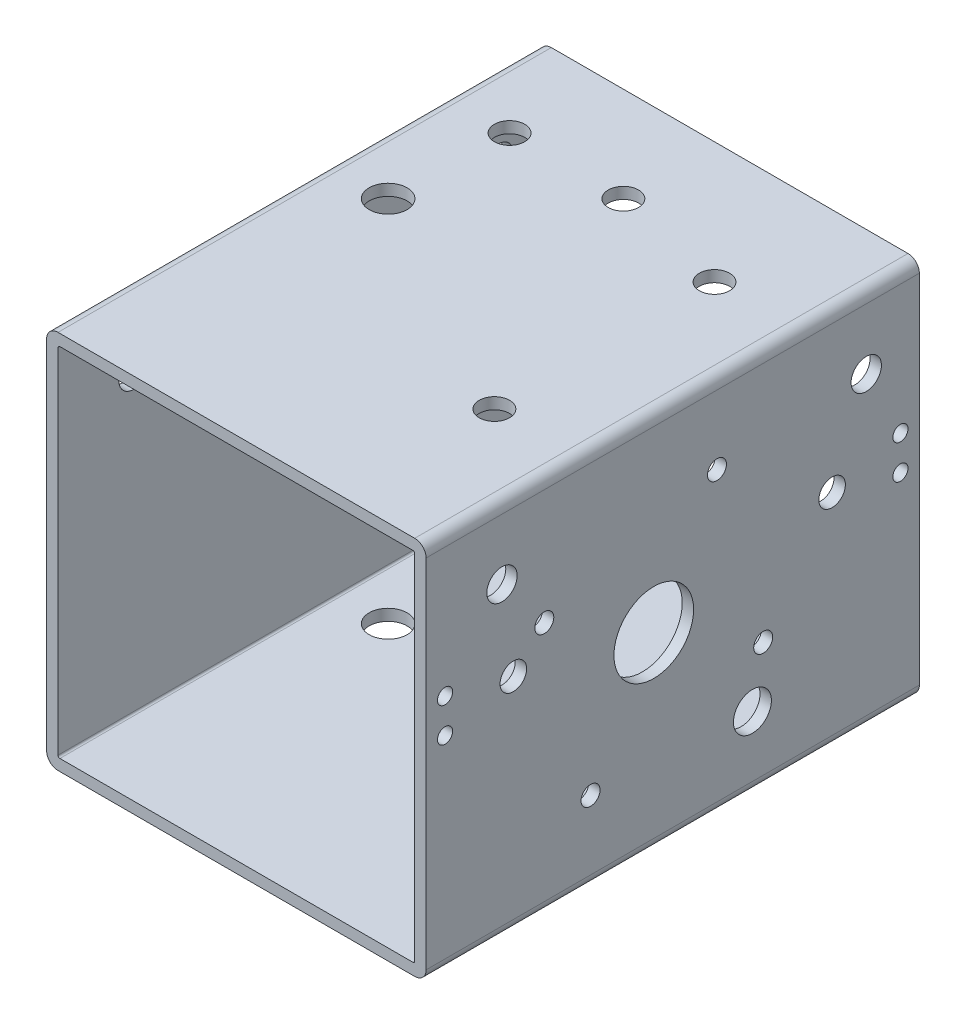
from build123d import *

# Parameters (mm, degrees)
SKETCH1_W                      = 100
SKETCH1_H                      = 100
SKETCH1_W_2                    = 94
SKETCH1_H_2                    = 94
EXTRUDE_THIN1_DEPTH            = 130
FILLET1_R                      = 0.5
FILLET2_R                      = 3
F_8_0_8_DIAMETER_HOLE2_D       = 8
F_8_0_8_DIAMETER_HOLE3_D       = 8
F_10_0_10_DIAMETER_HOLE1_D     = 10
F_10_0_10_DIAMETER_HOLE2_D     = 10
M8X1_25_TAPPED_HOLE1_D         = 6.8
M8X1_25_TAPPED_HOLE1_DEPTH     = 3
M8X1_25_TAPPED_HOLE2_D         = 6.8
M8X1_25_TAPPED_HOLE2_DEPTH     = 3
F_21_0_21_DIAMETER_HOLE1_D     = 21
F_21_0_21_DIAMETER_HOLE1_DEPTH = 3
F_5_0_5_DIAMETER_HOLE1_D       = 5
F_5_0_5_DIAMETER_HOLE1_DEPTH   = 3
F_8_0_8_DIAMETER_HOLE4_D       = 8
F_8_0_8_DIAMETER_HOLE4_DEPTH   = 3
CUT_EXTRUDE1_REACH             = 173.464
SKETCH31_R                     = 2
SKETCH31_R_2                   = 3.5
F_8_0_8_DIAMETER_HOLE5_D       = 8
F_8_0_8_DIAMETER_HOLE5_DEPTH   = 3


with BuildPart() as part:
    # Sketch1 → Extrude-Thin1 (new body)
    with BuildSketch(Plane.XY):
        Rectangle(SKETCH1_W, SKETCH1_H)
        Rectangle(SKETCH1_W_2, SKETCH1_H_2, mode=Mode.SUBTRACT)
    extrude(amount=EXTRUDE_THIN1_DEPTH)

    # Fillet1
    fillet1_edges = [part.edges().sort_by_distance(p)[0] for p in [
        (47, -47, 65),
        (47, 47, 65),
        (-47, 47, 65),
        (-47, -47, 65),
    ]]
    fillet(fillet1_edges, radius=FILLET1_R)

    # Fillet2
    fillet2_edges = [part.edges().sort_by_distance(p)[0] for p in [
        (50, -50, 65),
        (-50, -50, 65),
        (-50, 50, 65),
        (50, 50, 65),
    ]]
    fillet(fillet2_edges, radius=FILLET2_R)

    # Ø8.0 (8) Diameter Hole2 (through all)
    with Locations(Plane(origin=(0, 50, 0), x_dir=(1, 0, 0), z_dir=(0, 1, 0))):
        with Locations((28, -32), (28, -90)):
            Hole(F_8_0_8_DIAMETER_HOLE2_D / 2)

    # Ø8.0 (8) Diameter Hole3 (through all)
    with Locations(Plane(origin=(50, 0, 0), x_dir=(0, 0, -1), z_dir=(1, 0, 0))):
        with Locations((-14, 31), (-110, 31)):
            Hole(F_8_0_8_DIAMETER_HOLE3_D / 2)

    # Ø10.0 (10) Diameter Hole1 (through all)
    with Locations(Plane(origin=(0, 50, 0), x_dir=(1, 0, 0), z_dir=(0, 1, 0))):
        with Locations((-34, -56)):
            Hole(F_10_0_10_DIAMETER_HOLE1_D / 2)

    # Ø10.0 (10) Diameter Hole2 (through all)
    with Locations(Plane(origin=(50, 0, 0), x_dir=(0, 0, -1), z_dir=(1, 0, 0))):
        with Locations((-44, -31)):
            Hole(F_10_0_10_DIAMETER_HOLE2_D / 2)

    # M8x1.25 Tapped Hole1
    with Locations(Plane.ZY.offset(50)):
        with Locations((56, -15), (56, 35)):
            Hole(M8X1_25_TAPPED_HOLE1_D / 2, depth=M8X1_25_TAPPED_HOLE1_DEPTH)

    # M8x1.25 Tapped Hole2
    with Locations(Plane(origin=(0, -50, 0), x_dir=(-1, 0, 0), z_dir=(0, -1, 0))):
        with Locations((20, -44), (-35, -44)):
            Hole(M8X1_25_TAPPED_HOLE2_D / 2, depth=M8X1_25_TAPPED_HOLE2_DEPTH)

    # Ø21.0 (21) Diameter Hole1
    with Locations(Plane(origin=(50, 0, 0), x_dir=(0, 0, -1), z_dir=(1, 0, 0))):
        with Locations((-70, 0)):
            Hole(F_21_0_21_DIAMETER_HOLE1_D / 2, depth=F_21_0_21_DIAMETER_HOLE1_DEPTH)

    # Ø5.0 (5) Diameter Hole1
    with Locations(Plane(origin=(50, 0, 0), x_dir=(0, 0, -1), z_dir=(1, 0, 0))):
        with Locations((-41.157258279, -16.652364697), (-53.347635303, 28.842741721), (-98.842741721, 16.652364697), (-86.652364697, -28.842741721)):
            Hole(F_5_0_5_DIAMETER_HOLE1_D / 2, depth=F_5_0_5_DIAMETER_HOLE1_DEPTH)

    # Ø8.0 (8) Diameter Hole4
    with Locations(Plane(origin=(0, 50, 0), x_dir=(1, 0, 0), z_dir=(0, 1, 0))):
        with Locations((-3, -25)):
            Hole(F_8_0_8_DIAMETER_HOLE4_D / 2, depth=F_8_0_8_DIAMETER_HOLE4_DEPTH)

    # Sketch31 → Cut-Extrude1 (cut, up to next)
    with BuildSketch(Plane(origin=(50, 0, 0), x_dir=(0, 0, -1), z_dir=(1, 0, 0)), mode=Mode.PRIVATE) as cut_extrude1_sk1:
        with Locations(Location((-5, 4, 0), (0, 0, 90))):
            Circle(SKETCH31_R)
    cut_extrude1_tool1 = extrude(cut_extrude1_sk1.sketch, amount=-CUT_EXTRUDE1_REACH, mode=Mode.PRIVATE) & part.part
    # Sketch31 → Cut-Extrude1 (cut, up to next)
    with BuildSketch(Plane(origin=(50, 0, 0), x_dir=(0, 0, -1), z_dir=(1, 0, 0)), mode=Mode.PRIVATE) as cut_extrude1_sk2:
        with Locations(Location((-5, 13, 0), (0, 0, 90))):
            Circle(SKETCH31_R)
    cut_extrude1_tool2 = extrude(cut_extrude1_sk2.sketch, amount=-CUT_EXTRUDE1_REACH, mode=Mode.PRIVATE) & part.part
    # Sketch31 → Cut-Extrude1 (cut, up to next)
    with BuildSketch(Plane(origin=(50, 0, 0), x_dir=(0, 0, -1), z_dir=(1, 0, 0)), mode=Mode.PRIVATE) as cut_extrude1_sk3:
        with Locations(Location((-125, 13, 0), (0, 0, 90))):
            Circle(SKETCH31_R)
    cut_extrude1_tool3 = extrude(cut_extrude1_sk3.sketch, amount=-CUT_EXTRUDE1_REACH, mode=Mode.PRIVATE) & part.part
    # Sketch31 → Cut-Extrude1 (cut, up to next)
    with BuildSketch(Plane(origin=(50, 0, 0), x_dir=(0, 0, -1), z_dir=(1, 0, 0)), mode=Mode.PRIVATE) as cut_extrude1_sk4:
        with Locations(Location((-125, 4, 0), (0, 0, 90))):
            Circle(SKETCH31_R)
    cut_extrude1_tool4 = extrude(cut_extrude1_sk4.sketch, amount=-CUT_EXTRUDE1_REACH, mode=Mode.PRIVATE) & part.part
    # Sketch31 → Cut-Extrude1 (cut, up to next)
    with BuildSketch(Plane(origin=(50, 0, 0), x_dir=(0, 0, -1), z_dir=(1, 0, 0)), mode=Mode.PRIVATE) as cut_extrude1_sk5:
        with Locations(Location((-23, 8.5, 0), (0, 0, 90))):
            Circle(SKETCH31_R_2)
    cut_extrude1_tool5 = extrude(cut_extrude1_sk5.sketch, amount=-CUT_EXTRUDE1_REACH, mode=Mode.PRIVATE) & part.part
    # Sketch31 → Cut-Extrude1 (cut, up to next)
    with BuildSketch(Plane(origin=(50, 0, 0), x_dir=(0, 0, -1), z_dir=(1, 0, 0)), mode=Mode.PRIVATE) as cut_extrude1_sk6:
        with Locations(Location((-107, 8.5, 0), (0, 0, 90))):
            Circle(SKETCH31_R_2)
    cut_extrude1_tool6 = extrude(cut_extrude1_sk6.sketch, amount=-CUT_EXTRUDE1_REACH, mode=Mode.PRIVATE) & part.part
    add(cut_extrude1_tool1.solids().sort_by_distance((50, 4, 5))[0], mode=Mode.SUBTRACT)
    add(cut_extrude1_tool2.solids().sort_by_distance((50, 13, 5))[0], mode=Mode.SUBTRACT)
    add(cut_extrude1_tool3.solids().sort_by_distance((50, 13, 125))[0], mode=Mode.SUBTRACT)
    add(cut_extrude1_tool4.solids().sort_by_distance((50, 4, 125))[0], mode=Mode.SUBTRACT)
    add(cut_extrude1_tool5.solids().sort_by_distance((50, 8.5, 23))[0], mode=Mode.SUBTRACT)
    add(cut_extrude1_tool6.solids().sort_by_distance((50, 8.5, 107))[0], mode=Mode.SUBTRACT)

    # Ø8.0 (8) Diameter Hole5
    with Locations(Plane(origin=(0, 50, 0), x_dir=(1, 0, 0), z_dir=(0, 1, 0))):
        with Locations((-33, -25)):
            Hole(F_8_0_8_DIAMETER_HOLE5_D / 2, depth=F_8_0_8_DIAMETER_HOLE5_DEPTH)


solid = part.part
